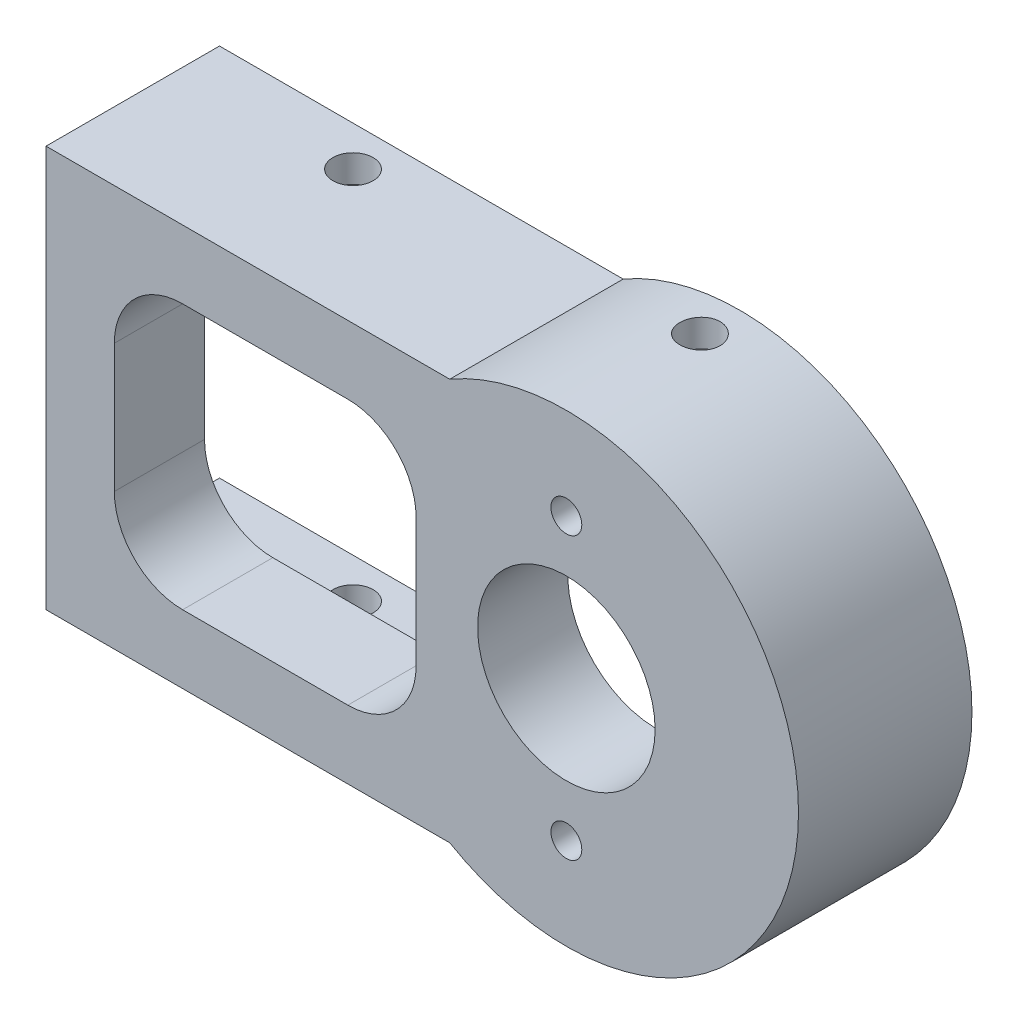
from build123d import *

# Parameters (mm, degrees)
SKETCH2_R           = 6.5
SKETCH2_R_2         = 1.1303
SKETCH2_W           = 22.1
SKETCH2_H           = 19.4
BOSS_EXTRUDE1_DEPTH = 12.7
CUT_EXTRUDE1_DEPTH  = 6.096
FILLET1_R           = 5
SKETCH6_R           = 1.4732
CUT_EXTRUDE4_DEPTH  = 53.620338273


with BuildPart() as part:
    # Sketch2 → Boss-Extrude1 (new body)
    with BuildSketch(Plane.XY):
        with BuildLine():
            Line((-38.1, -14.7), (-38.1, 14.7))
            Line((-38.1, 14.7), (-8.538735269, 14.7))
            ThreePointArc((-8.538735269, 14.7), (17, 0), (-8.538735269, -14.7))
            Line((-8.538735269, -14.7), (-38.1, -14.7))
        make_face()
        Circle(SKETCH2_R, mode=Mode.SUBTRACT)
        with Locations((0, -10.294657794)):
            Circle(SKETCH2_R_2, mode=Mode.SUBTRACT)
        with Locations((0, 10.294657794)):
            Circle(SKETCH2_R_2, mode=Mode.SUBTRACT)
        with Locations((-22.05, 0)):
            Rectangle(SKETCH2_W, SKETCH2_H, mode=Mode.SUBTRACT)
    extrude(amount=BOSS_EXTRUDE1_DEPTH)

    # Sketch1 → Cut-Extrude1 (cut)
    with BuildSketch(Plane.XY):
        with BuildLine():
            Line((-38.1, -12.7), (-38.1, 12.7))
            Line((-38.1, 12.7), (-7.981854421, 12.7))
            ThreePointArc((-7.981854421, 12.7), (15, 0), (-7.981854421, -12.7))
            Line((-7.981854421, -12.7), (-38.1, -12.7))
        make_face()
    extrude(amount=CUT_EXTRUDE1_DEPTH, mode=Mode.SUBTRACT)

    # Fillet1
    fillet1_edges = [part.edges().sort_by_distance(p)[0] for p in [
        (-33.1, 9.7, 9.398),
        (-33.1, -9.7, 9.398),
        (-11, -9.7, 9.398),
        (-11, 9.7, 9.398),
    ]]
    fillet(fillet1_edges, radius=FILLET1_R)

    # Sketch6 → Cut-Extrude4 (cut, through all)
    with BuildSketch(Plane(origin=(0, -17, 0), x_dir=(-1, 0, 0), z_dir=(0, -1, 0))):
        with Locations(Location((0, -2.921, 0), (0, 0, 180))):
            Circle(SKETCH6_R)
        with Locations(Location((25.4, -2.921, 0), (0, 0, 270))):
            Circle(SKETCH6_R)
    extrude(amount=-CUT_EXTRUDE4_DEPTH, mode=Mode.SUBTRACT)


solid = part.part
